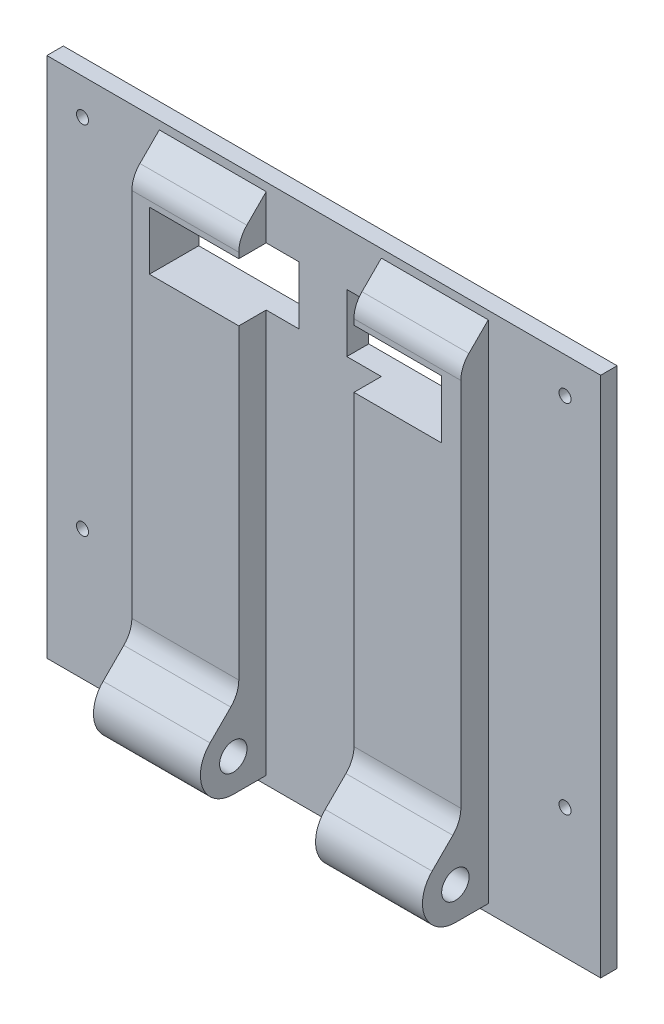
from build123d import *

# Parameters (mm, degrees)
SKETCH1_W                = 101
SKETCH1_H                = 95.2
SKETCH1_R                = 1.1
SKETCH1_W_2              = 22.3
SKETCH1_H_2              = 10.6
BOSS_EXTRUDE1_DEPTH      = 3
BOSS_EXTRUDE3_DEPTH      = 30
BOSS_EXTRUDE3_DEPTH_BACK = 30
SKETCH5_R                = 2.5
CUT_EXTRUDE1_START       = -40.5
CUT_EXTRUDE1_DEPTH       = 21
SKETCH9_W                = 22.3
SKETCH9_H                = 10.6
CUT_EXTRUDE4_DEPTH       = 10
SKETCH10_W               = 95
SKETCH10_H               = 89.2
BOSS_EXTRUDE4_DEPTH      = 1
CUT_EXTRUDE5_START       = -1.2
SKETCH11_R               = 1.1
SKETCH11_W               = 22.3
SKETCH11_H               = 10.6
CUT_EXTRUDE5_DEPTH       = 1.2


with BuildPart() as part:
    # Sketch1 → Boss-Extrude1 (new body)
    with BuildSketch(Plane.XY):
        Rectangle(SKETCH1_W, SKETCH1_H)
        with Locations((44, 41.1)):
            Circle(SKETCH1_R, mode=Mode.SUBTRACT)
        with Locations((44, -23.9)):
            Circle(SKETCH1_R, mode=Mode.SUBTRACT)
        with Locations((-44, 41.1)):
            Circle(SKETCH1_R, mode=Mode.SUBTRACT)
        with Locations((-44, -23.9)):
            Circle(SKETCH1_R, mode=Mode.SUBTRACT)
        with Locations((-15.65, 32.7)):
            Rectangle(SKETCH1_W_2, SKETCH1_H_2, mode=Mode.SUBTRACT)
        with Locations((15.35, 32.7)):
            Rectangle(SKETCH1_W_2, SKETCH1_H_2, mode=Mode.SUBTRACT)
    extrude(amount=BOSS_EXTRUDE1_DEPTH)

    # Sketch5 → Boss-Extrude3 (add, two sides: drawn at the far end of the back side and taken through both)
    with BuildSketch(Plane(origin=(0, 0, 0), x_dir=(0, -1, 0), z_dir=(-1, 0, 0)).offset(-BOSS_EXTRUDE3_DEPTH_BACK)):
        with BuildLine():
            Line((46.1, 9), (46.1, 3))
            Line((46.1, 3), (25.614718626, 3))
            Line((25.614718626, 3), (-46.1, 3))
            Line((-46.1, 3), (-42.564466094, 6.535533906))
            ThreePointArc((-42.564466094, 6.535533906), (-40.94234935, 7.619397663), (-39.028932188, 8))
            Line((-39.028932188, 8), (28.543650814, 8))
            ThreePointArc((28.543650814, 8), (30.457067976, 8.380602337), (32.07918472, 9.464466094))
            Line((32.07918472, 9.464466094), (35.857359313, 13.242640687))
            ThreePointArc((35.857359313, 13.242640687), (42.396100594, 14.543277195), (46.1, 9))
        make_face()
        with Locations((40.1, 9)):
            Circle(SKETCH5_R, mode=Mode.SUBTRACT)
    extrude(amount=BOSS_EXTRUDE3_DEPTH + BOSS_EXTRUDE3_DEPTH_BACK)

    # Sketch7 → Cut-Extrude1 (cut)
    with BuildSketch(Plane.ZY.offset(30).offset(CUT_EXTRUDE1_START)):
        with BuildLine():
            Line((3, 46.1), (3, -46.1))
            Line((3, -46.1), (9, -46.1))
            ThreePointArc((9, -46.1), (14.543277195, -42.396100594), (13.242640687, -35.857359313))
            Line((13.242640687, -35.857359313), (9.464466094, -32.07918472))
            ThreePointArc((9.464466094, -32.07918472), (8.380602337, -30.457067976), (8, -28.543650814))
            Line((8, -28.543650814), (8, 39.028932188))
            ThreePointArc((8, 39.028932188), (7.619397663, 40.94234935), (6.535533906, 42.564466094))
            Line((6.535533906, 42.564466094), (3, 46.1))
        make_face()
    extrude(amount=CUT_EXTRUDE1_DEPTH, mode=Mode.SUBTRACT)

    # Sketch9 → Cut-Extrude4 (cut)
    with BuildSketch(Plane.XY.offset(3)):
        with Locations((15.35, 32.7)):
            Rectangle(SKETCH9_W, SKETCH9_H)
        with Locations((-15.65, 32.7)):
            Rectangle(SKETCH9_W, SKETCH9_H)
    extrude(amount=CUT_EXTRUDE4_DEPTH, mode=Mode.SUBTRACT)

    # Sketch10 → Boss-Extrude4 (add)
    with BuildSketch(Plane(origin=(0, 0, 0), x_dir=(-1, 0, 0), z_dir=(0, 0, -1))):
        Rectangle(SKETCH10_W, SKETCH10_H)
    extrude(amount=BOSS_EXTRUDE4_DEPTH)

    # Sketch11 → Cut-Extrude5 (cut)
    with BuildSketch(Plane.XY.offset(CUT_EXTRUDE5_START)):
        with Locations(Location((-44, 41.1, 0), (0, 0, 180))):
            Circle(SKETCH11_R)
        with Locations(Location((-44, -23.9, 0), (0, 0, 180))):
            Circle(SKETCH11_R)
        with Locations(Location((44, -23.9, 0), (0, 0, 180))):
            Circle(SKETCH11_R)
        with Locations(Location((44, 41.1, 0), (0, 0, 180))):
            Circle(SKETCH11_R)
        with Locations((15.35, 32.7)):
            Rectangle(SKETCH11_W, SKETCH11_H)
        with Locations((-15.65, 32.7)):
            Rectangle(SKETCH11_W, SKETCH11_H)
    extrude(amount=CUT_EXTRUDE5_DEPTH, mode=Mode.SUBTRACT)


solid = part.part
